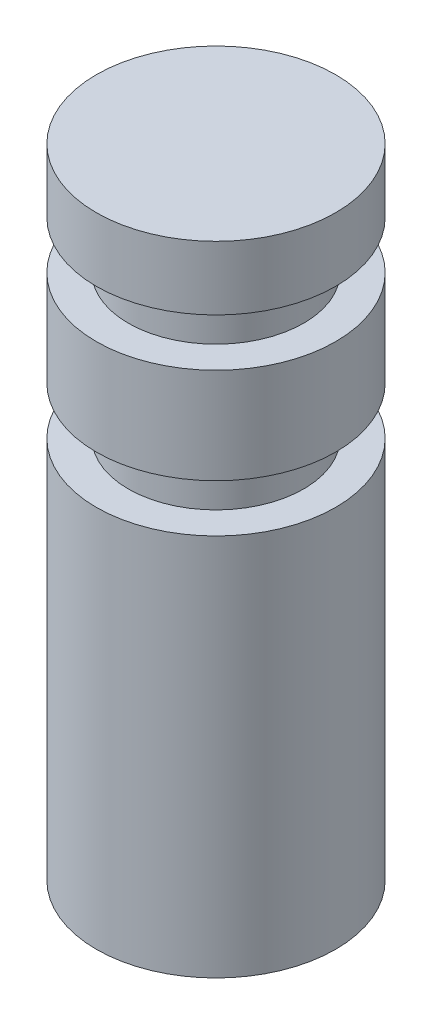
from build123d import *

# Parameters (mm, degrees)
SKETCH1_R           = 4.7625
BOSS_EXTRUDE1_DEPTH = 25.4
SKETCH2_W           = 2.54
SKETCH2_H           = 1.905


with BuildPart() as part:
    # Sketch1 → Boss-Extrude1 (new body)
    with BuildSketch(Plane(origin=(0, 0, 0), x_dir=(1, 0, 0), z_dir=(0, 1, 0))):
        with Locations(Location((0, 0, 0), (0, 0, 270))):
            Circle(SKETCH1_R)
    extrude(amount=BOSS_EXTRUDE1_DEPTH)

    # Sketch2 → Cut-Revolve1 (revolve, cut)
    with BuildSketch(Plane(origin=(0, 0, 0), x_dir=(0, 0, -1), z_dir=(1, 0, 0)), mode=Mode.PRIVATE) as cut_revolve1_sk:
        with Locations((4.7625, 21.9075)):
            Rectangle(SKETCH2_W, SKETCH2_H)
        with Locations((4.7625, 16.1925)):
            Rectangle(SKETCH2_W, SKETCH2_H)
    revolve(cut_revolve1_sk.sketch.rotate(Axis((0, 25.4, 0), (0, -1, 0)), 180), axis=Axis((0, 25.4, 0), (0, -1, 0)), mode=Mode.SUBTRACT)


solid = part.part
